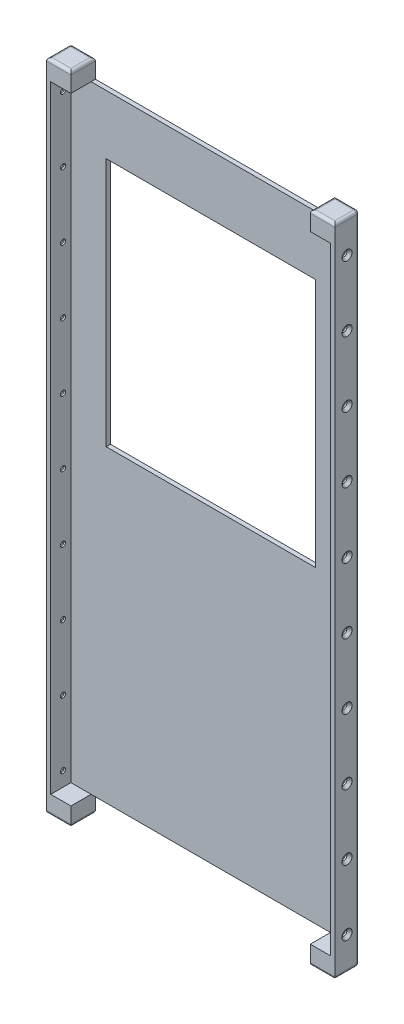
from build123d import *

# Parameters (mm, degrees)
BOSS_EXTRUDE1_DEPTH                           = 8.5
FILLET1_R                                     = 1
SKETCH2_W                                     = 83
SKETCH2_H                                     = 214
CUT_EXTRUDE1_DEPTH                            = 7
SKETCH3_W                                     = 97
SKETCH3_H                                     = 214
CUT_EXTRUDE2_DEPTH                            = 7
SKETCH6_W                                     = 36.25
SKETCH6_H                                     = 86.5
CUT_EXTRUDE3_DEPTH                            = 10
CSK_FOR_0_FLAT_HEAD_MACHINE_SCREW1_AT_2_COUNT = 2
CSK_FOR_0_FLAT_HEAD_MACHINE_SCREW1_AT_2_PITCH = 22.666666667
CSK_FOR_0_FLAT_HEAD_MACHINE_SCREW1_AT_3_COUNT = 2
CSK_FOR_0_FLAT_HEAD_MACHINE_SCREW1_AT_3_PITCH = 45.333333333
CSK_FOR_0_FLAT_HEAD_MACHINE_SCREW1_AT_4_COUNT = 2
CSK_FOR_0_FLAT_HEAD_MACHINE_SCREW1_AT_4_PITCH = 68
CSK_FOR_0_FLAT_HEAD_MACHINE_SCREW1_AT_5_COUNT = 2
CSK_FOR_0_FLAT_HEAD_MACHINE_SCREW1_AT_5_PITCH = 90.666666667
CSK_FOR_0_FLAT_HEAD_MACHINE_SCREW1_AT_6_COUNT = 2
CSK_FOR_0_FLAT_HEAD_MACHINE_SCREW1_AT_6_PITCH = 113.333333333
CSK_FOR_0_FLAT_HEAD_MACHINE_SCREW1_AT_7_COUNT = 2
CSK_FOR_0_FLAT_HEAD_MACHINE_SCREW1_AT_7_PITCH = 136
CSK_FOR_0_FLAT_HEAD_MACHINE_SCREW1_AT_8_COUNT = 2
CSK_FOR_0_FLAT_HEAD_MACHINE_SCREW1_AT_8_PITCH = 158.666666667
CSK_FOR_0_FLAT_HEAD_MACHINE_SCREW1_AT_9_COUNT = 2
CSK_FOR_0_FLAT_HEAD_MACHINE_SCREW1_AT_9_PITCH = 181.333333333
CSK_FOR_0_FLAT_HEAD_MACHINE_SCREW1_AT_1_COUNT = 2
CSK_FOR_0_FLAT_HEAD_MACHINE_SCREW1_AT_1_PITCH = 204


with BuildPart() as part:
    # Sketch1 → Boss-Extrude1 (new body)
    with BuildSketch(Plane.XY):
        Polygon((-41.5, -107), (41.5, -107), (41.5, -113.5), (50, -113.5), (50, -107), (50, 107), (50, 113.5), (41.5, 113.5), (41.5, 107), (-41.5, 107), (-41.5, 113.5), (-50, 113.5), (-50, 107), (-50, -107), (-50, -113.5), (-41.5, -113.5), align=None)
    extrude(amount=BOSS_EXTRUDE1_DEPTH)

    # Fillet1
    fillet1_edges = [part.edges().sort_by_distance(p)[0] for p in [
        (50, 0, 0),
        (45.75, -113.5, 0),
        (-45.75, -113.5, 0),
        (-50, 0, 0),
        (-45.75, 113.5, 0),
        (-45.75, 113.5, 8.5),
        (45.75, 113.5, 0),
        (50, -113.5, 4.25),
        (41.5, -113.5, 4.25),
        (-41.5, -113.5, 4.25),
        (-50, -113.5, 4.25),
        (-50, 113.5, 4.25),
        (-41.5, 113.5, 4.25),
        (41.5, 113.5, 4.25),
        (50, 113.5, 4.25),
        (-45.75, -113.5, 8.5),
        (45.75, -113.5, 8.5),
        (45.75, 113.5, 8.5),
    ]]
    fillet(fillet1_edges, radius=FILLET1_R)

    # Sketch2 → Cut-Extrude1 (cut)
    with BuildSketch(Plane.XY.offset(8.5)):
        Rectangle(SKETCH2_W, SKETCH2_H)
    extrude(amount=-CUT_EXTRUDE1_DEPTH, mode=Mode.SUBTRACT)

    # Sketch3 → Cut-Extrude2 (cut)
    with BuildSketch(Plane.XY.offset(8.5)):
        Rectangle(SKETCH3_W, SKETCH3_H)
    extrude(amount=-CUT_EXTRUDE2_DEPTH, mode=Mode.SUBTRACT)

    # Sketch6 → Cut-Extrude3 (cut)
    with BuildSketch(Plane(origin=(0, 0, 0), x_dir=(-1, 0, 0), z_dir=(0, 0, -1))):
        with Locations((-18.125, 43.25)):
            Rectangle(SKETCH6_W, SKETCH6_H)
        with Locations((18.125, 43.25)):
            Rectangle(SKETCH6_W, SKETCH6_H)
    extrude(amount=-CUT_EXTRUDE3_DEPTH, mode=Mode.SUBTRACT)

    # Sketch7 → CSK for #0 Flat Head Machine Screw1 (revolve, cut)
    with BuildSketch(Plane(origin=(50, 102, 4.25), x_dir=(0, 0, -1), z_dir=(0, 1, 0))):
        Polygon((0, 0), (0, 3.83616509), (0.889, 3.302), (0.889, 0.969878135), (1.7321022, 0), align=None)
    csk_for_0_flat_head_machine_screw1 = revolve(axis=Axis((56.35, 102, 4.25), (-1, 0, 0)), mode=Mode.SUBTRACT)

    # CSK for #0 Flat Head Machine Screw1 at 2: CSK for #0 Flat Head Machine Screw1 ×2
    with Locations(*[(0, -i * CSK_FOR_0_FLAT_HEAD_MACHINE_SCREW1_AT_2_PITCH, 0) for i in range(1, CSK_FOR_0_FLAT_HEAD_MACHINE_SCREW1_AT_2_COUNT)]):
        add(csk_for_0_flat_head_machine_screw1, mode=Mode.SUBTRACT)

    # CSK for #0 Flat Head Machine Screw1 at 3: CSK for #0 Flat Head Machine Screw1 ×2
    with Locations(*[(0, -i * CSK_FOR_0_FLAT_HEAD_MACHINE_SCREW1_AT_3_PITCH, 0) for i in range(1, CSK_FOR_0_FLAT_HEAD_MACHINE_SCREW1_AT_3_COUNT)]):
        add(csk_for_0_flat_head_machine_screw1, mode=Mode.SUBTRACT)

    # CSK for #0 Flat Head Machine Screw1 at 4: CSK for #0 Flat Head Machine Screw1 ×2
    with Locations(*[(0, -i * CSK_FOR_0_FLAT_HEAD_MACHINE_SCREW1_AT_4_PITCH, 0) for i in range(1, CSK_FOR_0_FLAT_HEAD_MACHINE_SCREW1_AT_4_COUNT)]):
        add(csk_for_0_flat_head_machine_screw1, mode=Mode.SUBTRACT)

    # CSK for #0 Flat Head Machine Screw1 at 5: CSK for #0 Flat Head Machine Screw1 ×2
    with Locations(*[(0, -i * CSK_FOR_0_FLAT_HEAD_MACHINE_SCREW1_AT_5_PITCH, 0) for i in range(1, CSK_FOR_0_FLAT_HEAD_MACHINE_SCREW1_AT_5_COUNT)]):
        add(csk_for_0_flat_head_machine_screw1, mode=Mode.SUBTRACT)

    # CSK for #0 Flat Head Machine Screw1 at 6: CSK for #0 Flat Head Machine Screw1 ×2
    with Locations(*[(0, -i * CSK_FOR_0_FLAT_HEAD_MACHINE_SCREW1_AT_6_PITCH, 0) for i in range(1, CSK_FOR_0_FLAT_HEAD_MACHINE_SCREW1_AT_6_COUNT)]):
        add(csk_for_0_flat_head_machine_screw1, mode=Mode.SUBTRACT)

    # CSK for #0 Flat Head Machine Screw1 at 7: CSK for #0 Flat Head Machine Screw1 ×2
    with Locations(*[(0, -i * CSK_FOR_0_FLAT_HEAD_MACHINE_SCREW1_AT_7_PITCH, 0) for i in range(1, CSK_FOR_0_FLAT_HEAD_MACHINE_SCREW1_AT_7_COUNT)]):
        add(csk_for_0_flat_head_machine_screw1, mode=Mode.SUBTRACT)

    # CSK for #0 Flat Head Machine Screw1 at 8: CSK for #0 Flat Head Machine Screw1 ×2
    with Locations(*[(0, -i * CSK_FOR_0_FLAT_HEAD_MACHINE_SCREW1_AT_8_PITCH, 0) for i in range(1, CSK_FOR_0_FLAT_HEAD_MACHINE_SCREW1_AT_8_COUNT)]):
        add(csk_for_0_flat_head_machine_screw1, mode=Mode.SUBTRACT)

    # CSK for #0 Flat Head Machine Screw1 at 9: CSK for #0 Flat Head Machine Screw1 ×2
    with Locations(*[(0, -i * CSK_FOR_0_FLAT_HEAD_MACHINE_SCREW1_AT_9_PITCH, 0) for i in range(1, CSK_FOR_0_FLAT_HEAD_MACHINE_SCREW1_AT_9_COUNT)]):
        add(csk_for_0_flat_head_machine_screw1, mode=Mode.SUBTRACT)

    # CSK for #0 Flat Head Machine Screw1 at 1: CSK for #0 Flat Head Machine Screw1 ×2
    with Locations(*[(0, -i * CSK_FOR_0_FLAT_HEAD_MACHINE_SCREW1_AT_1_PITCH, 0) for i in range(1, CSK_FOR_0_FLAT_HEAD_MACHINE_SCREW1_AT_1_COUNT)]):
        add(csk_for_0_flat_head_machine_screw1, mode=Mode.SUBTRACT)

    # Mirror1: CSK for #0 Flat Head Machine Screw1 across plane
    add(csk_for_0_flat_head_machine_screw1.mirror(Plane(origin=(0, 0, 0), x_dir=(0, 0, 1), z_dir=(1, 0, 0))), mode=Mode.SUBTRACT)

    # Mirror1 copy 1 sketch → Mirror1 copy 1 (revolve, cut)
    with BuildSketch(Plane(origin=(-50, 79.333333333, 4.25), x_dir=(0, 0, -1), z_dir=(0, 1, 0))):
        Polygon((0, 0), (0, -3.83616509), (0.889, -3.302), (0.889, -0.969878135), (1.7321022, 0), align=None)
    revolve(axis=Axis((-56.35, 79.333333333, 4.25), (-1, 0, 0)), mode=Mode.SUBTRACT)

    # Mirror1 copy 2 sketch → Mirror1 copy 2 (revolve, cut)
    with BuildSketch(Plane(origin=(-50, 56.666666667, 4.25), x_dir=(0, 0, -1), z_dir=(0, 1, 0))):
        Polygon((0, 0), (0, -3.83616509), (0.889, -3.302), (0.889, -0.969878135), (1.7321022, 0), align=None)
    revolve(axis=Axis((-56.35, 56.666666667, 4.25), (-1, 0, 0)), mode=Mode.SUBTRACT)

    # Mirror1 copy 3 sketch → Mirror1 copy 3 (revolve, cut)
    with BuildSketch(Plane(origin=(-50, 34, 4.25), x_dir=(0, 0, -1), z_dir=(0, 1, 0))):
        Polygon((0, 0), (0, -3.83616509), (0.889, -3.302), (0.889, -0.969878135), (1.7321022, 0), align=None)
    revolve(axis=Axis((-56.35, 34, 4.25), (-1, 0, 0)), mode=Mode.SUBTRACT)

    # Mirror1 copy 4 sketch → Mirror1 copy 4 (revolve, cut)
    with BuildSketch(Plane(origin=(-50, 11.333333333, 4.25), x_dir=(0, 0, -1), z_dir=(0, 1, 0))):
        Polygon((0, 0), (0, -3.83616509), (0.889, -3.302), (0.889, -0.969878135), (1.7321022, 0), align=None)
    revolve(axis=Axis((-56.35, 11.333333333, 4.25), (-1, 0, 0)), mode=Mode.SUBTRACT)

    # Mirror1 copy 5 sketch → Mirror1 copy 5 (revolve, cut)
    with BuildSketch(Plane(origin=(-50, -11.333333333, 4.25), x_dir=(0, 0, -1), z_dir=(0, 1, 0))):
        Polygon((0, 0), (0, -3.83616509), (0.889, -3.302), (0.889, -0.969878135), (1.7321022, 0), align=None)
    revolve(axis=Axis((-56.35, -11.333333333, 4.25), (-1, 0, 0)), mode=Mode.SUBTRACT)

    # Mirror1 copy 6 sketch → Mirror1 copy 6 (revolve, cut)
    with BuildSketch(Plane(origin=(-50, -34, 4.25), x_dir=(0, 0, -1), z_dir=(0, 1, 0))):
        Polygon((0, 0), (0, -3.83616509), (0.889, -3.302), (0.889, -0.969878135), (1.7321022, 0), align=None)
    revolve(axis=Axis((-56.35, -34, 4.25), (-1, 0, 0)), mode=Mode.SUBTRACT)

    # Mirror1 copy 7 sketch → Mirror1 copy 7 (revolve, cut)
    with BuildSketch(Plane(origin=(-50, -56.666666667, 4.25), x_dir=(0, 0, -1), z_dir=(0, 1, 0))):
        Polygon((0, 0), (0, -3.83616509), (0.889, -3.302), (0.889, -0.969878135), (1.7321022, 0), align=None)
    revolve(axis=Axis((-56.35, -56.666666667, 4.25), (-1, 0, 0)), mode=Mode.SUBTRACT)

    # Mirror1 copy 8 sketch → Mirror1 copy 8 (revolve, cut)
    with BuildSketch(Plane(origin=(-50, -79.333333333, 4.25), x_dir=(0, 0, -1), z_dir=(0, 1, 0))):
        Polygon((0, 0), (0, -3.83616509), (0.889, -3.302), (0.889, -0.969878135), (1.7321022, 0), align=None)
    revolve(axis=Axis((-56.35, -79.333333333, 4.25), (-1, 0, 0)), mode=Mode.SUBTRACT)

    # Mirror1 copy 9 sketch → Mirror1 copy 9 (revolve, cut)
    with BuildSketch(Plane(origin=(-50, -102, 4.25), x_dir=(0, 0, -1), z_dir=(0, 1, 0))):
        Polygon((0, 0), (0, -3.83616509), (0.889, -3.302), (0.889, -0.969878135), (1.7321022, 0), align=None)
    revolve(axis=Axis((-56.35, -102, 4.25), (-1, 0, 0)), mode=Mode.SUBTRACT)


solid = part.part
